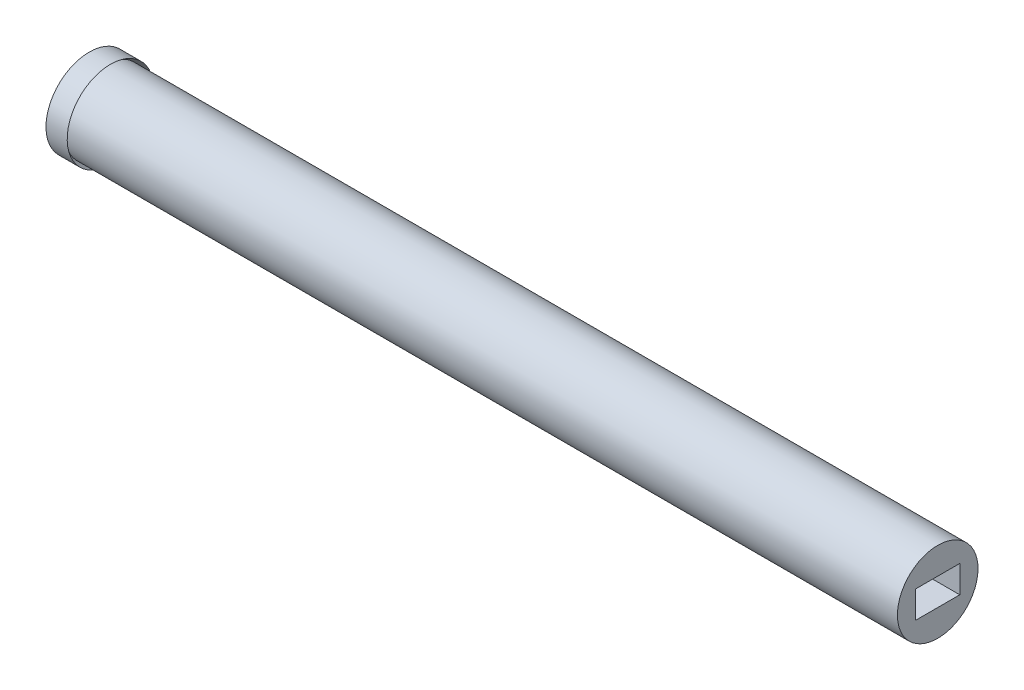
from build123d import *

# Parameters (mm, degrees)
SKETCH4_W          = 5.2
SKETCH4_H          = 3.2
CUT_EXTRUDE1_DEPTH = 4.3


with BuildPart() as part:
    # Sketch1 → Revolve2 (revolve)
    with BuildSketch(Plane.XY, mode=Mode.PRIVATE) as revolve2_sk:
        Polygon((0, 0), (2.5, 0), (1.893782217, 0.35), (100, 0.35), (100, 5.1), (0, 5.1), align=None)
    revolve(revolve2_sk.sketch.rotate(Axis((100, 5.1, 0), (-1, 0, 0)), 180), axis=Axis((100, 5.1, 0), (-1, 0, 0)))

    # Sketch4 → Cut-Extrude1 (cut)
    with BuildSketch(Plane(origin=(100, 0, 0), x_dir=(0, 0, -1), z_dir=(1, 0, 0))):
        with Locations((0, 5.1)):
            Rectangle(SKETCH4_W, SKETCH4_H)
    extrude(amount=-CUT_EXTRUDE1_DEPTH, mode=Mode.SUBTRACT)


solid = part.part
